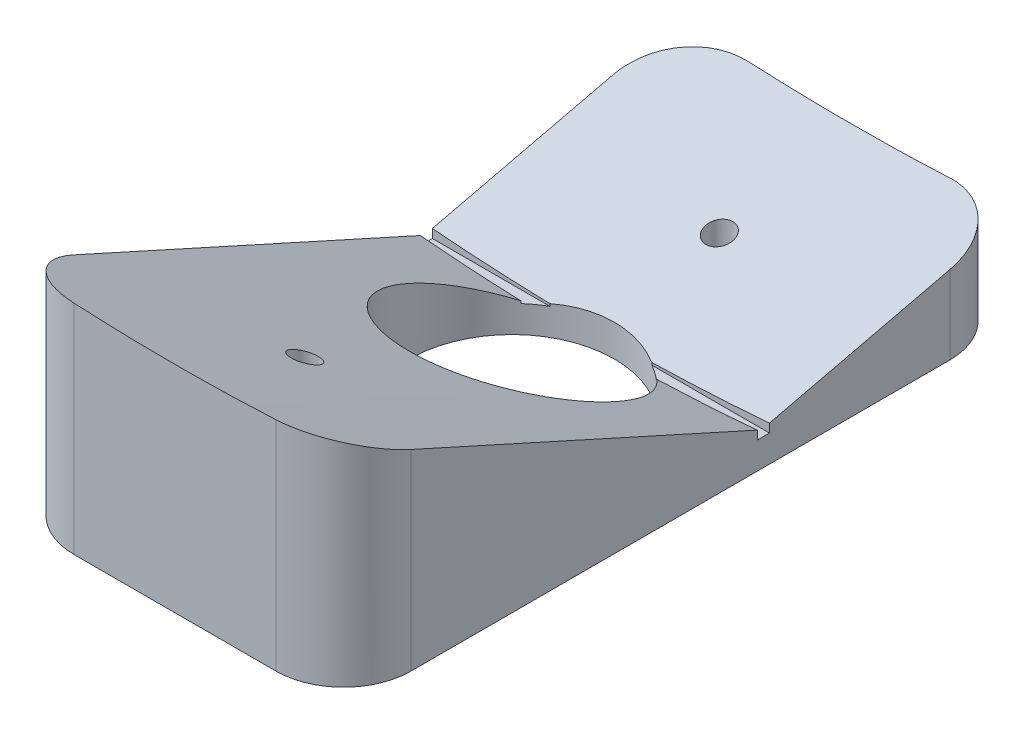
from build123d import *

# Parameters (mm, degrees)
SKETCH1_W                      = 50
SKETCH1_H                      = 100
SKETCH1_R                      = 15.2
SKETCH1_R_2                    = 2
BOSS_EXTRUDE1_DEPTH            = 33
CUT_EXTRUDE1_DEPTH             = 79.0320447
CHAMFER1_SIZE                  = 2.5
CUT_EXTRUDE2_DEPTH             = 68.029405
CUT_EXTRUDE4_DEPTH             = 39.051248
SKETCH6_W                      = 1.8
SKETCH6_H                      = 1.279654747
CUT_EXTRUDE5_DEPTH             = 79.03204487
FILLET1_R                      = 10
F_4_5_4_5_DIAMETER_HOLE1_D     = 4.5
F_4_5_4_5_DIAMETER_HOLE1_DEPTH = 8
F_4_5_4_5_DIAMETER_HOLE1_TIP   = 1.351936393


with BuildPart() as part:
    # Sketch1 → Boss-Extrude1 (new body)
    with BuildSketch(Plane(origin=(0, 0, 0), x_dir=(1, 0, 0), z_dir=(0, 1, 0))):
        Rectangle(SKETCH1_W, SKETCH1_H)
        with Locations(Location((0, 0, 0), (0, 0, 270))):
            Circle(SKETCH1_R, mode=Mode.SUBTRACT)
        with Locations(Location((0, 30.75, 0), (0, 0, 270))):
            Circle(SKETCH1_R_2, mode=Mode.SUBTRACT)
        with Locations(Location((0, -30.75, 0), (0, 0, 270))):
            Circle(SKETCH1_R_2, mode=Mode.SUBTRACT)
    extrude(amount=BOSS_EXTRUDE1_DEPTH)

    # Sketch2 → Cut-Extrude1 (cut, through all)
    with BuildSketch(Plane(origin=(25, 0, 0), x_dir=(0, 0, -1), z_dir=(1, 0, 0))):
        Polygon((50, 14), (12, 5), (-50, 33), (50, 33), align=None)
    extrude(amount=-CUT_EXTRUDE1_DEPTH, mode=Mode.SUBTRACT)

    # Chamfer1
    chamfer1_edges = [part.edges().sort_by_distance(p)[0] for p in [
        (0, 0, -32.75),
        (0, 0, 28.75),
    ]]
    chamfer(chamfer1_edges, length=CHAMFER1_SIZE)

    # Sketch3 → Cut-Extrude2 (cut)
    with BuildSketch(Plane(origin=(0, 24.345721694, 53.908383751), x_dir=(-1, 0, 0), z_dir=(0, -0.4115867224264983, -0.9113705996586748))):
        with BuildLine():
            Line((25, 9.495893667), (-25, 9.495893667))
            ThreePointArc((-25, 9.495893667), (0, 8.495893667), (25, 9.495893667))
        make_face()
    extrude(amount=CUT_EXTRUDE2_DEPTH, mode=Mode.SUBTRACT)

    # Sketch4 → Cut-Extrude4 (cut)
    with BuildSketch(Plane(origin=(0, 11.956721311, -50.483934426), x_dir=(-1, 0, 0), z_dir=(0, 0.23046638387921348, -0.9730802874900093))):
        with BuildLine():
            Line((25, 2.099804831), (-25, 2.099804831))
            ThreePointArc((-25, 2.099804831), (0, 1.099804831), (25, 2.099804831))
        make_face()
    extrude(amount=-CUT_EXTRUDE4_DEPTH, mode=Mode.SUBTRACT)

    # Sketch6 → Cut-Extrude5 (cut, through all)
    with BuildSketch(Plane.ZY.offset(25)):
        with Locations((-12.280764488, 4.639827374)):
            Rectangle(SKETCH6_W, SKETCH6_H)
    extrude(amount=-CUT_EXTRUDE5_DEPTH, mode=Mode.SUBTRACT)

    # Fillet1
    fillet1_edges = [part.edges().sort_by_distance(p)[0] for p in [
        (25, 16.5, 50),
        (25, 7, -50),
        (-25, 7, -50),
        (-25, 16.5, 50),
    ]]
    fillet(fillet1_edges, radius=FILLET1_R)

    # Ø4.5 (4.5) Diameter Hole1
    with Locations(Plane.XZ):
        with Locations((0, 42.5), (0, -42.5)):
            Hole(F_4_5_4_5_DIAMETER_HOLE1_D / 2, depth=F_4_5_4_5_DIAMETER_HOLE1_DEPTH)
            with Locations((0, 0, -(F_4_5_4_5_DIAMETER_HOLE1_DEPTH + F_4_5_4_5_DIAMETER_HOLE1_TIP / 2))):  # 118° drill point
                Cone(0, F_4_5_4_5_DIAMETER_HOLE1_D / 2, F_4_5_4_5_DIAMETER_HOLE1_TIP, mode=Mode.SUBTRACT)


solid = part.part
